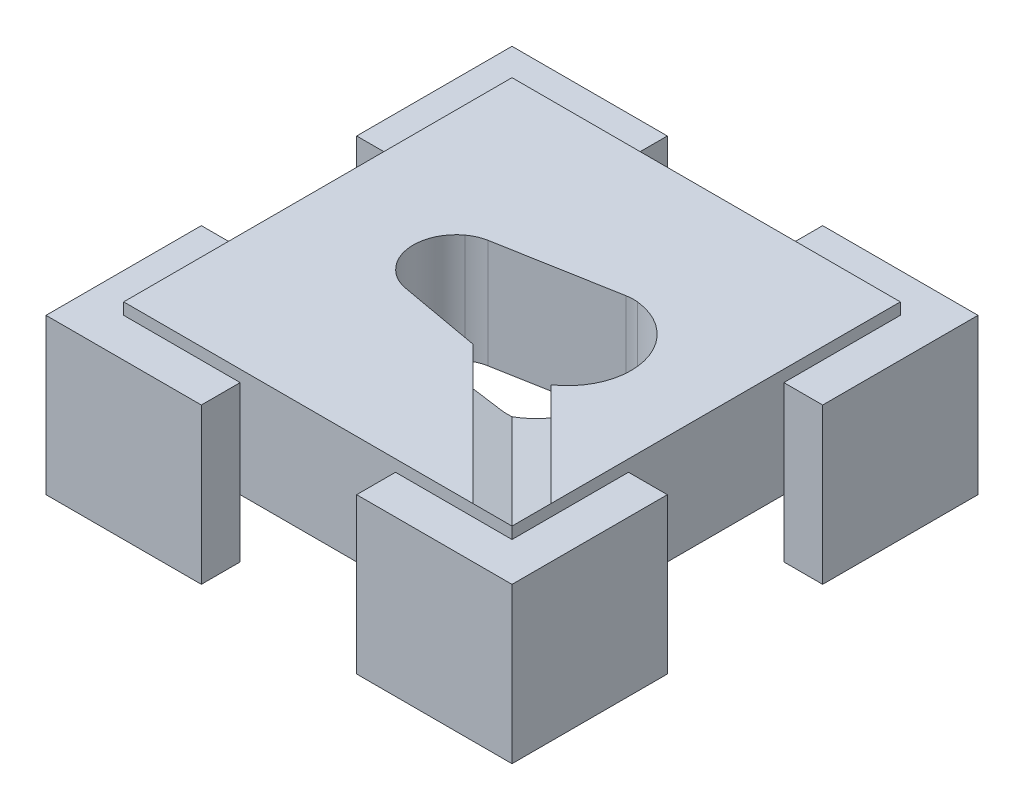
from build123d import *

# Parameters (mm, degrees)
BOSS_EXTRUDE2_DEPTH   = 2.5
BOSS_EXTRUDE2_2_DEPTH = 2.5
BOSS_EXTRUDE2_3_DEPTH = 2.5
BOSS_EXTRUDE2_4_DEPTH = 2.5
BOSS_EXTRUDE3_DEPTH   = 1.5
SKETCH1_W             = 10
SKETCH1_H             = 10
BOSS_EXTRUDE4_DEPTH   = 2.8
CUT_EXTRUDE11_DEPTH   = 1
CUT_EXTRUDE14_DEPTH   = 1


with BuildPart() as part:
    # Sketch2 → Boss-Extrude2 (new body)
    with BuildSketch(Plane(origin=(0, 0, 0), x_dir=(1, 0, 0), z_dir=(0, 1, 0))):
        Polygon((-2, 6), (-6, 6), (-6, 2), (-5, 2), (-5, 5), (-2, 5), align=None)
    extrude(amount=BOSS_EXTRUDE2_DEPTH)



with BuildPart() as body_2:
    # Sketch2 → Boss-Extrude2 2 (new body)
    with BuildSketch(Plane(origin=(0, 0, 0), x_dir=(1, 0, 0), z_dir=(0, 1, 0))):
        Polygon((2, 6), (2, 5), (5, 5), (5, 2), (6, 2), (6, 6), align=None)
    extrude(amount=BOSS_EXTRUDE2_2_DEPTH)


with BuildPart() as body_3:
    # Sketch2 → Boss-Extrude2 3 (new body)
    with BuildSketch(Plane(origin=(0, 0, 0), x_dir=(1, 0, 0), z_dir=(0, 1, 0))):
        Polygon((5, -2), (5, -5), (2, -5), (2, -6), (6, -6), (6, -2), align=None)
    extrude(amount=BOSS_EXTRUDE2_3_DEPTH)


with BuildPart() as body_4:
    # Sketch2 → Boss-Extrude2 4 (new body)
    with BuildSketch(Plane(origin=(0, 0, 0), x_dir=(1, 0, 0), z_dir=(0, 1, 0))):
        Polygon((-6, -2), (-5, -2), (-5, -5), (-2, -5), (-2, -6), (-6, -6), align=None)
    extrude(amount=BOSS_EXTRUDE2_4_DEPTH)

    # Sketch2<4> → Boss-Extrude3 (add)
    with BuildSketch(Plane(origin=(0, 0, 0), x_dir=(1, 0, 0), z_dir=(0, 1, 0))):
        Polygon((-2, 6), (-6, 6), (-6, 2), (-5, 2), (-5, 5), (-2, 5), align=None)
        Polygon((2, 6), (2, 5), (5, 5), (5, 2), (6, 2), (6, 6), align=None)
        Polygon((5, -2), (5, -5), (2, -5), (2, -6), (6, -6), (6, -2), align=None)
        Polygon((-6, -2), (-5, -2), (-5, -5), (-2, -5), (-2, -6), (-6, -6), align=None)
    extrude(amount=-BOSS_EXTRUDE3_DEPTH)


with BuildPart() as boss_extrude3_piece_1:
    # of the separate pieces the step leaves, piece 1, a body of its own (boss_extrude3_pieces)
    add(body_4.part.solids().sort_by_distance((-6, 2.5, 2))[0])


with BuildPart() as boss_extrude3_piece_2:
    # of the separate pieces the step leaves, piece 2, a body of its own (boss_extrude3_pieces)
    add(body_4.part.solids().sort_by_distance((-2, 0, -6))[0])


with BuildPart() as boss_extrude3_piece_3:
    # of the separate pieces the step leaves, piece 3, a body of its own (boss_extrude3_pieces)
    add(body_4.part.solids().sort_by_distance((2, 0, -6))[0])


with BuildPart() as boss_extrude3_piece_4:
    # of the separate pieces the step leaves, piece 4, a body of its own (boss_extrude3_pieces)
    add(body_4.part.solids().sort_by_distance((5, 0, 2))[0])


with BuildPart() as part_1:
    add(part.part)

    add(body_2.part)  # Boss-Extrude4 merges body 2

    add(body_3.part)  # Boss-Extrude4 merges body 3

    add(boss_extrude3_piece_1.part)  # Boss-Extrude4 merges Boss-Extrude3 piece 1

    add(boss_extrude3_piece_2.part)  # Boss-Extrude4 merges Boss-Extrude3 piece 2

    add(boss_extrude3_piece_3.part)  # Boss-Extrude4 merges Boss-Extrude3 piece 3

    add(boss_extrude3_piece_4.part)  # Boss-Extrude4 merges Boss-Extrude3 piece 4
    # Sketch1 → Boss-Extrude4 (add)
    with BuildSketch(Plane(origin=(0, 0, 0), x_dir=(1, 0, 0), z_dir=(0, 1, 0))):
        Rectangle(SKETCH1_W, SKETCH1_H)
        with BuildLine():
            ThreePointArc((1.617598637, -1.615265837), (3.065, 0), (1.617598637, 1.615265837))
            ThreePointArc((1.617598637, 1.615265837), (1.474163525, 1.620673027), (1.331431871, 1.605489361))
            Line((1.331431871, 1.605489361), (-1.677221968, 1.064808042))
            ThreePointArc((-1.677221968, 1.064808042), (-1.895132853, 0.999347796), (-2.092605578, 0.886322491))
            ThreePointArc((-2.092605578, 0.886322491), (-2.54112078, 0), (-2.092605578, -0.886322491))
            ThreePointArc((-2.092605578, -0.886322491), (-1.895132853, -0.999347796), (-1.677221968, -1.064808042))
            Line((-1.677221968, -1.064808042), (1.331431871, -1.605489361))
            ThreePointArc((1.331431871, -1.605489361), (1.474163525, -1.620673027), (1.617598637, -1.615265837))
        make_face(mode=Mode.SUBTRACT)
    extrude(amount=BOSS_EXTRUDE4_DEPTH)

    # 3DSketch1 → Cut-Extrude11 (cut, along a direction that is not the sketch's normal)
    with BuildSketch(Plane(origin=(5, 2.8, 5), x_dir=(-0.693702510890827, -0.1937876486453734, -0.6937025108908424), z_dir=(0.7071067811865555, 0, -0.7071067811865397))):
        Polygon((0, 0), (-0.732362778, 3.707562105), (7.206933902, 0), align=None)
    extrude(amount=-CUT_EXTRUDE11_DEPTH, dir=(1, 0, 0), mode=Mode.SUBTRACT)

    # 3DSketch1<9> → Cut-Extrude14 (cut, along a direction that is not the sketch's normal)
    with BuildSketch(Plane(origin=(5, 2.8, 5), x_dir=(-0.693702510890827, -0.1937876486453734, -0.6937025108908424), z_dir=(0.7071067811865555, 0, -0.7071067811865397))):
        Polygon((0, 0), (-0.732362778, 3.707562105), (7.206933902, 0), align=None)
    extrude(amount=CUT_EXTRUDE14_DEPTH, dir=(0, 0, -1), mode=Mode.SUBTRACT)


solid = part_1.part
